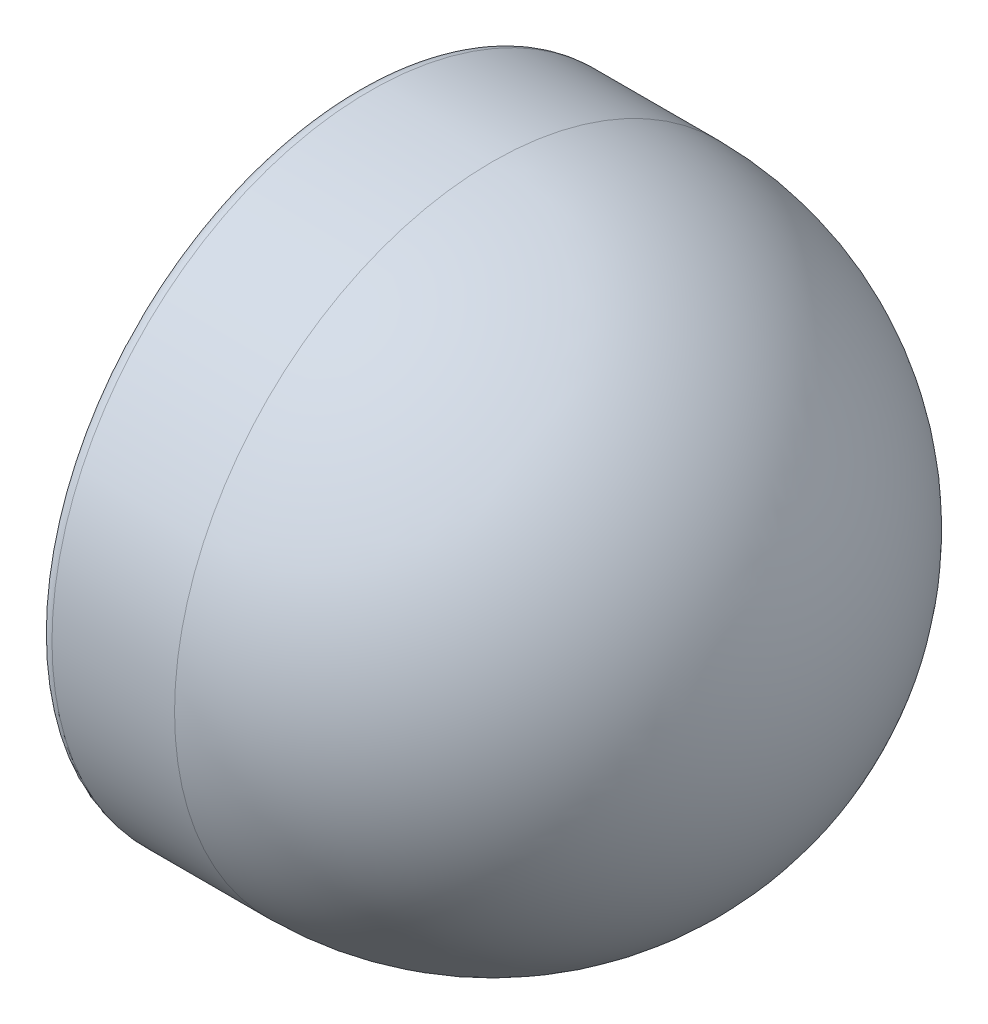
from build123d import *


with BuildPart() as part:
    # Sketch1 → Revolve1 (revolve)
    with BuildSketch(Plane.XY, mode=Mode.PRIVATE) as revolve1_sk:
        with BuildLine():
            Line((-70, 70), (-97, 70))
            ThreePointArc((-97, 70), (-99.121320344, 69.121320344), (-100, 67))
            Line((-100, 67), (-100, 61.5))
            ThreePointArc((-100, 61.5), (-99.560660172, 60.439339828), (-98.5, 60))
            Line((-98.5, 60), (-96.621320344, 60))
            ThreePointArc((-96.621320344, 60), (-96.047295195, 60.114180701), (-95.560660172, 60.439339828))
            Line((-95.560660172, 60.439339828), (-92.483834953, 63.516165047))
            Line((-92.483834953, 63.516165047), (-93.190941734, 64.223271828))
            Line((-93.190941734, 64.223271828), (-96.267766953, 61.146446609))
            ThreePointArc((-96.267766953, 61.146446609), (-96.429978627, 61.038060234), (-96.621320344, 61))
            Line((-96.621320344, 61), (-98.5, 61))
            ThreePointArc((-98.5, 61), (-98.853553391, 61.146446609), (-99, 61.5))
            Line((-99, 61.5), (-99, 67))
            ThreePointArc((-99, 67), (-98.414213562, 68.414213562), (-97, 69))
            Line((-97, 69), (-70, 69))
            ThreePointArc((-70, 69), (-21.209632098, 48.790367902), (-1, 0))
            Line((-1, 0), (0, 0))
            ThreePointArc((0, 0), (-20.502525317, 49.497474683), (-70, 70))
        make_face()
    revolve(revolve1_sk.sketch.rotate(Axis((-70, 0, 0), (1, 0, 0)), 90), axis=Axis((-70, 0, 0), (1, 0, 0)))


solid = part.part
